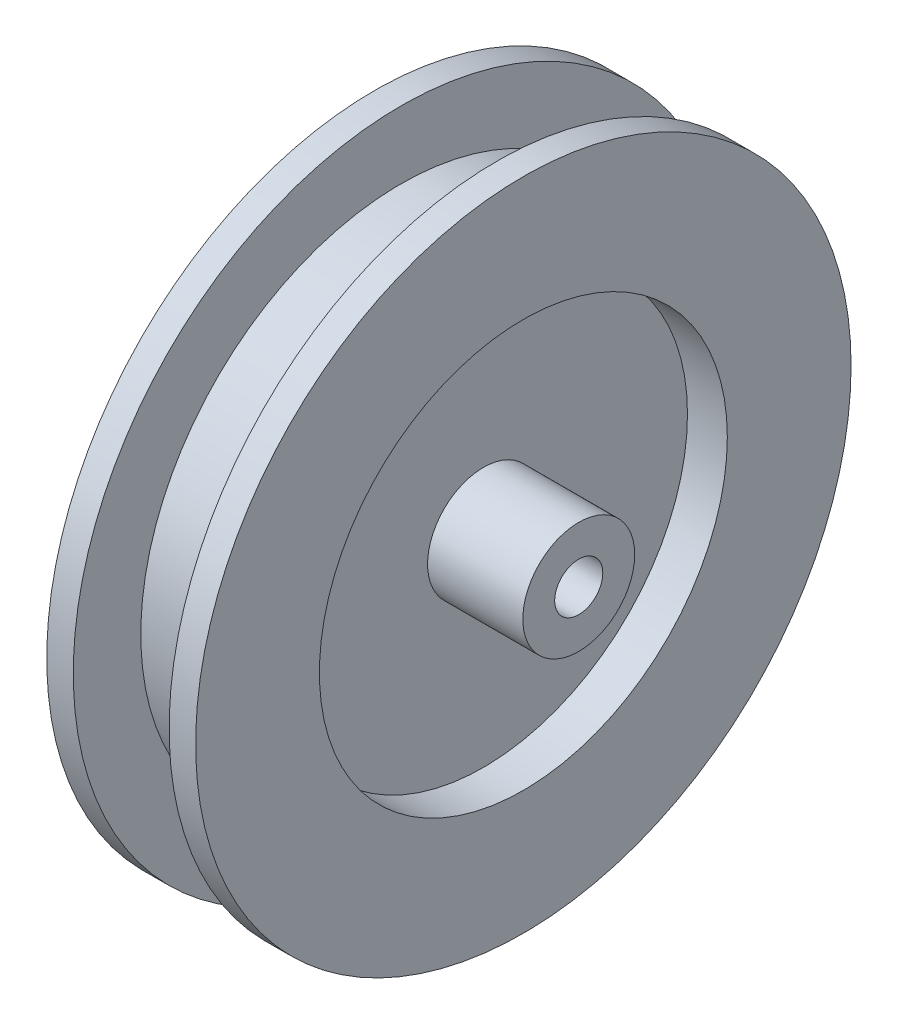
from build123d import *

# Parameters (mm, degrees)
SKETCH1_R           = 76.2635
BOSS_EXTRUDE1_DEPTH = 17.3228
SKETCH2_R           = 47.46625
CUT_EXTRUDE1_DEPTH  = 9.271
CUT_EXTRUDE2_START  = -15.8496
SKETCH2_2_R         = 47.46625
CUT_EXTRUDE2_DEPTH  = 18.796
CUT_EXTRUDE3_START  = -6.1722
SKETCH3_OUTSIDE_W   = 198.222
SKETCH3_OUTSIDE_H   = 198.222
SKETCH3_OUTSIDE_R   = 60.5536
CUT_EXTRUDE3_DEPTH  = 22.3012
SKETCH4_R           = 13.0175
BOSS_EXTRUDE2_DEPTH = 22.1615
SKETCH5_R           = 5.59435
CUT_EXTRUDE4_DEPTH  = 118.864004971


with BuildPart() as part:
    # Sketch1 → Boss-Extrude1 (new, symmetric)
    with BuildSketch(Plane(origin=(0, 0, 0), x_dir=(0, 0, -1), z_dir=(1, 0, 0))):
        Circle(SKETCH1_R)
    extrude(amount=BOSS_EXTRUDE1_DEPTH, both=True)

    # Sketch2 → Cut-Extrude1 (cut)
    with BuildSketch(Plane(origin=(17.3228, 0, 0), x_dir=(0, 0, -1), z_dir=(1, 0, 0))):
        Circle(SKETCH2_R)
    extrude(amount=-CUT_EXTRUDE1_DEPTH, mode=Mode.SUBTRACT)

    # Sketch2<2> → Cut-Extrude2 (cut)
    with BuildSketch(Plane(origin=(17.3228, 0, 0), x_dir=(0, 0, -1), z_dir=(1, 0, 0)).offset(CUT_EXTRUDE2_START)):
        Circle(SKETCH2_2_R)
    extrude(amount=-CUT_EXTRUDE2_DEPTH, mode=Mode.SUBTRACT)

    # Sketch3 outside → Cut-Extrude3 (cut)
    with BuildSketch(Plane(origin=(17.3228, 0, 0), x_dir=(0, 0, -1), z_dir=(1, 0, 0)).offset(CUT_EXTRUDE3_START)):
        Rectangle(SKETCH3_OUTSIDE_W, SKETCH3_OUTSIDE_H)
        Circle(SKETCH3_OUTSIDE_R, mode=Mode.SUBTRACT)
    extrude(amount=-CUT_EXTRUDE3_DEPTH, mode=Mode.SUBTRACT)

    # Sketch4 → Boss-Extrude2 (add)
    with BuildSketch(Plane(origin=(8.0518, 0, 0), x_dir=(0, 0, -1), z_dir=(1, 0, 0))):
        Circle(SKETCH4_R)
    extrude(amount=BOSS_EXTRUDE2_DEPTH)

    # Sketch5 → Cut-Extrude4 (cut, through all)
    with BuildSketch(Plane(origin=(30.2133, 0, 0), x_dir=(0, 0, -1), z_dir=(1, 0, 0))):
        Circle(SKETCH5_R)
    extrude(amount=-CUT_EXTRUDE4_DEPTH, mode=Mode.SUBTRACT)


solid = part.part
